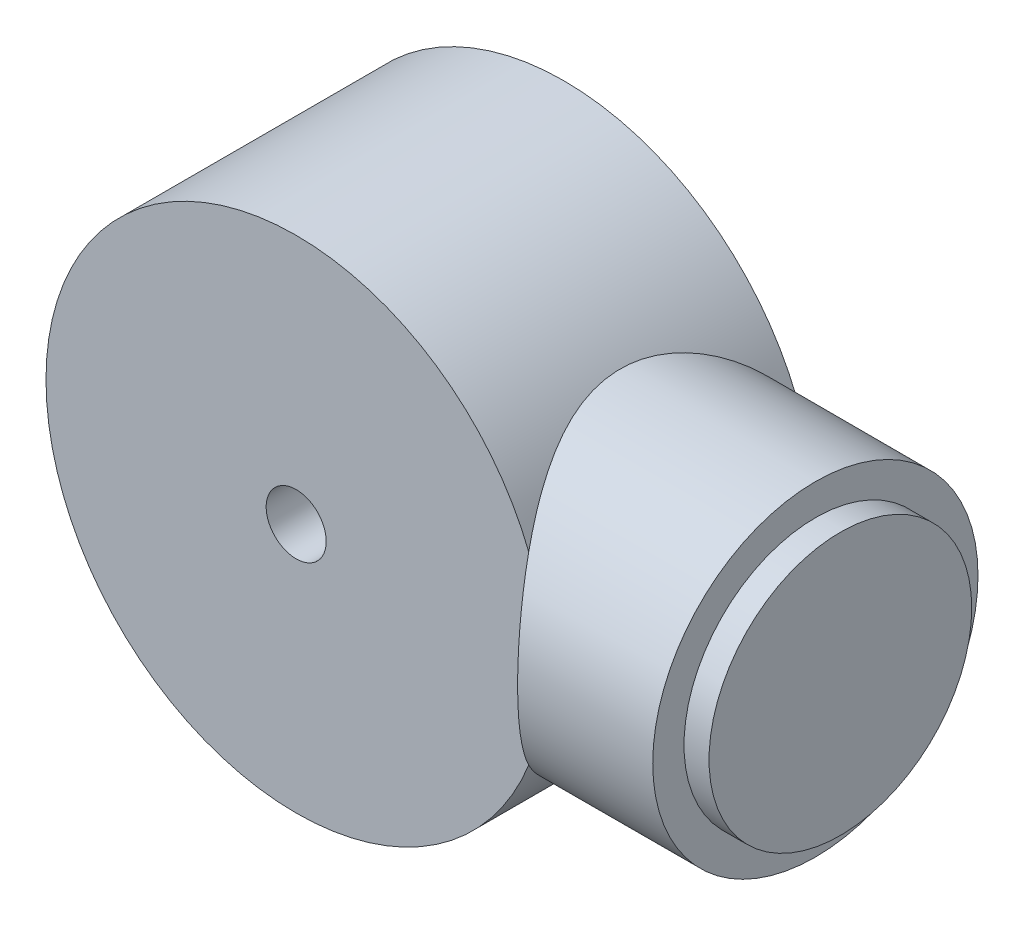
from build123d import *

# Parameters (mm, degrees)
ESBO_O1_R                     = 50
RESSALTO_EXTRUS_O1_DEPTH      = 26.75
RESSALTO_EXTRUS_O3_REACH      = 141.085
RESSALTO_EXTRUS_O3_END_RADIUS = 50
ESBO_O2_R                     = 32.5
ESBO_O3_R                     = 26.25
RESSALTO_EXTRUS_O4_DEPTH      = 5
ESBO_O4_R                     = 6
CORTE_EXTRUS_O1_DEPTH         = 113.8475189


with BuildPart() as part:
    # Esboço1 → Ressalto-extrusão1 (new, symmetric)
    with BuildSketch(Plane.XY):
        Circle(ESBO_O1_R)
    extrude(amount=RESSALTO_EXTRUS_O1_DEPTH, both=True)

    # Ressalto-extrusão3: up to this cylinder (the profile starts outside it)
    ressalto_extrus_o3_end = Plane(origin=(0, 0, 0), z_dir=(0, 0, -1)) * Cylinder(RESSALTO_EXTRUS_O3_END_RADIUS, 383.17, mode=Mode.PRIVATE)
    # Esboço2 → Ressalto-extrusão3 (add, up to the surface)
    with BuildSketch(Plane(origin=(77, 0, 0), x_dir=(0, 0, -1), z_dir=(1, 0, 0)), mode=Mode.PRIVATE) as ressalto_extrus_o3_sk1:
        Circle(ESBO_O2_R)
    ressalto_extrus_o3_tool1 = extrude(ressalto_extrus_o3_sk1.sketch, amount=-RESSALTO_EXTRUS_O3_REACH, mode=Mode.PRIVATE) - ressalto_extrus_o3_end
    add(ressalto_extrus_o3_tool1.solids().sort_by_distance((77, 0, 0))[0])

    # Esboço3 → Ressalto-extrusão4 (add)
    with BuildSketch(Plane(origin=(77, 0, 0), x_dir=(0, 0, -1), z_dir=(1, 0, 0))):
        Circle(ESBO_O3_R)
    extrude(amount=RESSALTO_EXTRUS_O4_DEPTH)

    # Esboço4 → Corte-extrusão1 (cut, through all)
    with BuildSketch(Plane.XY.offset(26.75)):
        Circle(ESBO_O4_R)
    extrude(amount=-CORTE_EXTRUS_O1_DEPTH, mode=Mode.SUBTRACT)


solid = part.part
